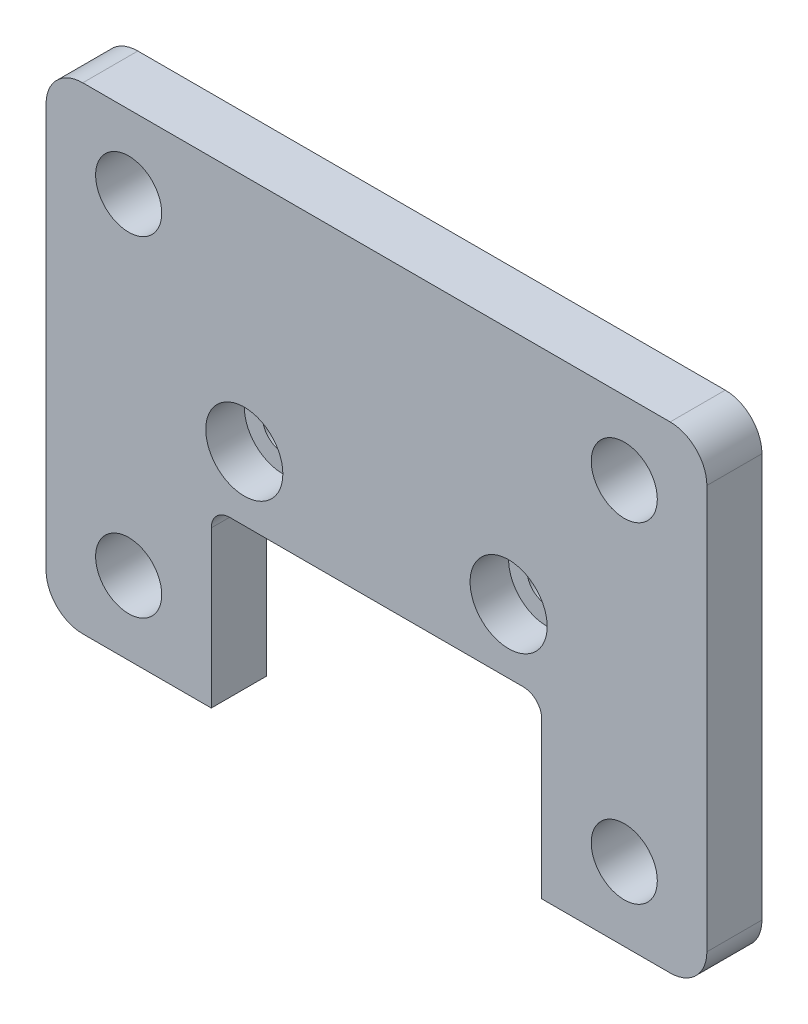
from build123d import *

# Parameters (mm, degrees)
EXTRUDE_START            = 5
EXTRUDE_3_Z5_DEPTH       = 3
CUT_EXTRUDE_START        = 5
CUT_EXTRUDE_U_18_DEPTH   = 3
EXTRUDE_START_2          = 3
SKETCH_3_R               = 2.75
EXTRUDE_2_Z3_5_DEPTH     = 2
SKETCH_4_R               = 2
EXTRUDE_3_Z0_3_DEPTH     = 3
SKETCH_5_R               = 1.1
CUT_EXTRUDE_2X_2_2_DEPTH = 8
CUT_EXTRUDE_START_2      = 5.9
SKETCH_6_R               = 2.1
CUT_EXTRUDE_2_1_DEPTH    = 2.1
SKETCH_7_R               = 1.8
CUT_EXTRUDE_4X_3_6_DEPTH = 3


with BuildPart() as part:
    # 草图1 → 背板拉伸_厚3_前面Z5 (new body)
    with BuildSketch(Plane.XY.offset(EXTRUDE_START)):
        with BuildLine():
            Line((-16, -13), (16, -13))
            ThreePointArc((16, -13), (17.414213562, -12.414213562), (18, -11))
            Line((18, -11), (18, 11))
            ThreePointArc((18, 11), (17.414213562, 12.414213562), (16, 13))
            Line((16, 13), (-16, 13))
            ThreePointArc((-16, 13), (-17.414213562, 12.414213562), (-18, 11))
            Line((-18, 11), (-18, -11))
            ThreePointArc((-18, -11), (-17.414213562, -12.414213562), (-16, -13))
        make_face()
    extrude(amount=EXTRUDE_3_Z5_DEPTH)

    # 草图2 → 下方U口_宽18_向下敞开 (cut)
    with BuildSketch(Plane.XY.offset(CUT_EXTRUDE_START)):
        with BuildLine():
            Line((-8, -20), (8, -20))
            ThreePointArc((8, -20), (8.707106781, -19.707106781), (9, -19))
            Line((9, -19), (9, -4.5))
            ThreePointArc((9, -4.5), (8.707106781, -3.792893219), (8, -3.5))
            Line((8, -3.5), (-8, -3.5))
            ThreePointArc((-8, -3.5), (-8.707106781, -3.792893219), (-9, -4.5))
            Line((-9, -4.5), (-9, -19))
            ThreePointArc((-9, -19), (-8.707106781, -19.707106781), (-8, -20))
        make_face()
    extrude(amount=CUT_EXTRUDE_U_18_DEPTH, mode=Mode.SUBTRACT)

    # 草图3 → 两根支柱主体_高2_Z3至5 (add)
    with BuildSketch(Plane.XY.offset(EXTRUDE_START_2)):
        with Locations((-7.2, 0)):
            Circle(SKETCH_3_R)
        with Locations((7.2, 0)):
            Circle(SKETCH_3_R)
    extrude(amount=EXTRUDE_2_Z3_5_DEPTH)

    # 草图4 → 两根接触细颈_高3_Z0至3 (add)
    with BuildSketch(Plane.XY):
        with Locations((-7.2, 0)):
            Circle(SKETCH_4_R)
        with Locations((7.2, 0)):
            Circle(SKETCH_4_R)
    extrude(amount=EXTRUDE_3_Z0_3_DEPTH)

    # 草图5 → 模块固定孔_2x直径2.2_贯穿 (cut)
    with BuildSketch(Plane.XY):
        with Locations((-7.2, 0)):
            Circle(SKETCH_5_R)
        with Locations((7.2, 0)):
            Circle(SKETCH_5_R)
    extrude(amount=CUT_EXTRUDE_2X_2_2_DEPTH, mode=Mode.SUBTRACT)

    # 草图6 → 背面螺丝头沉孔_深2.1 (cut)
    with BuildSketch(Plane.XY.offset(CUT_EXTRUDE_START_2)):
        with Locations((-7.2, 0)):
            Circle(SKETCH_6_R)
        with Locations((7.2, 0)):
            Circle(SKETCH_6_R)
    extrude(amount=CUT_EXTRUDE_2_1_DEPTH, mode=Mode.SUBTRACT)

    # 草图7 → 后续连接孔_4x直径3.6_贯穿 (cut)
    with BuildSketch(Plane.XY.offset(CUT_EXTRUDE_START)):
        with Locations((-13.5, -9)):
            Circle(SKETCH_7_R)
        with Locations((-13.5, 9)):
            Circle(SKETCH_7_R)
        with Locations((13.5, -9)):
            Circle(SKETCH_7_R)
        with Locations((13.5, 9)):
            Circle(SKETCH_7_R)
    extrude(amount=CUT_EXTRUDE_4X_3_6_DEPTH, mode=Mode.SUBTRACT)


solid = part.part
